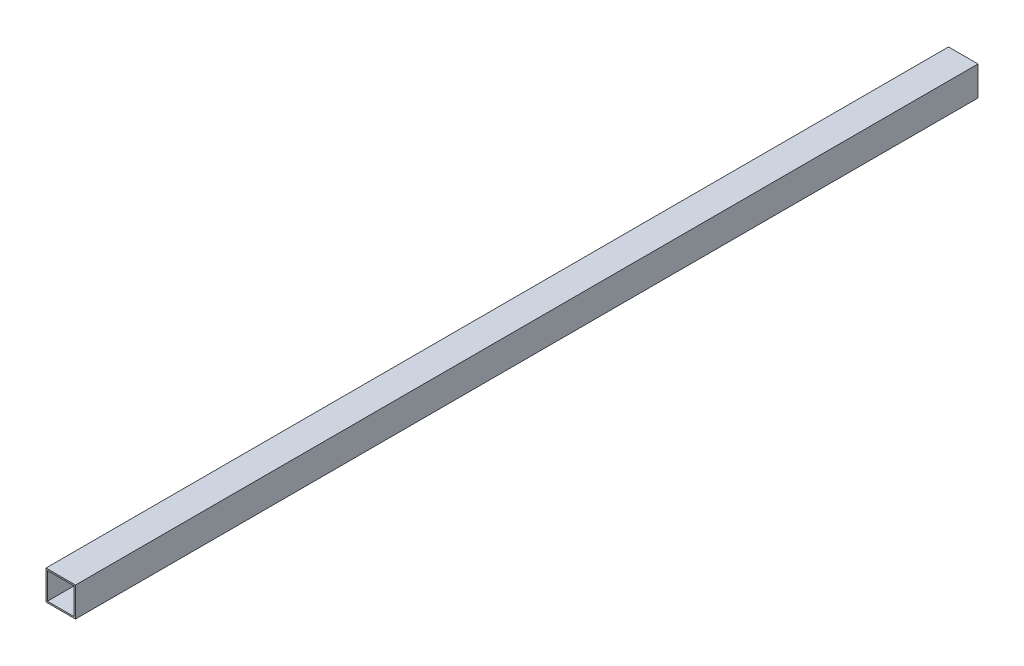
from build123d import *

# Parameters (mm, degrees)
SKETCH1_W           = 25
SKETCH1_H           = 25
SKETCH1_W_2         = 22.6
SKETCH1_H_2         = 22.6
BOSS_EXTRUDE1_DEPTH = 765


with BuildPart() as part:
    # Sketch1 → Boss-Extrude1 (new body)
    with BuildSketch(Plane.XY):
        Rectangle(SKETCH1_W, SKETCH1_H)
        Rectangle(SKETCH1_W_2, SKETCH1_H_2, mode=Mode.SUBTRACT)
    extrude(amount=BOSS_EXTRUDE1_DEPTH)


solid = part.part
